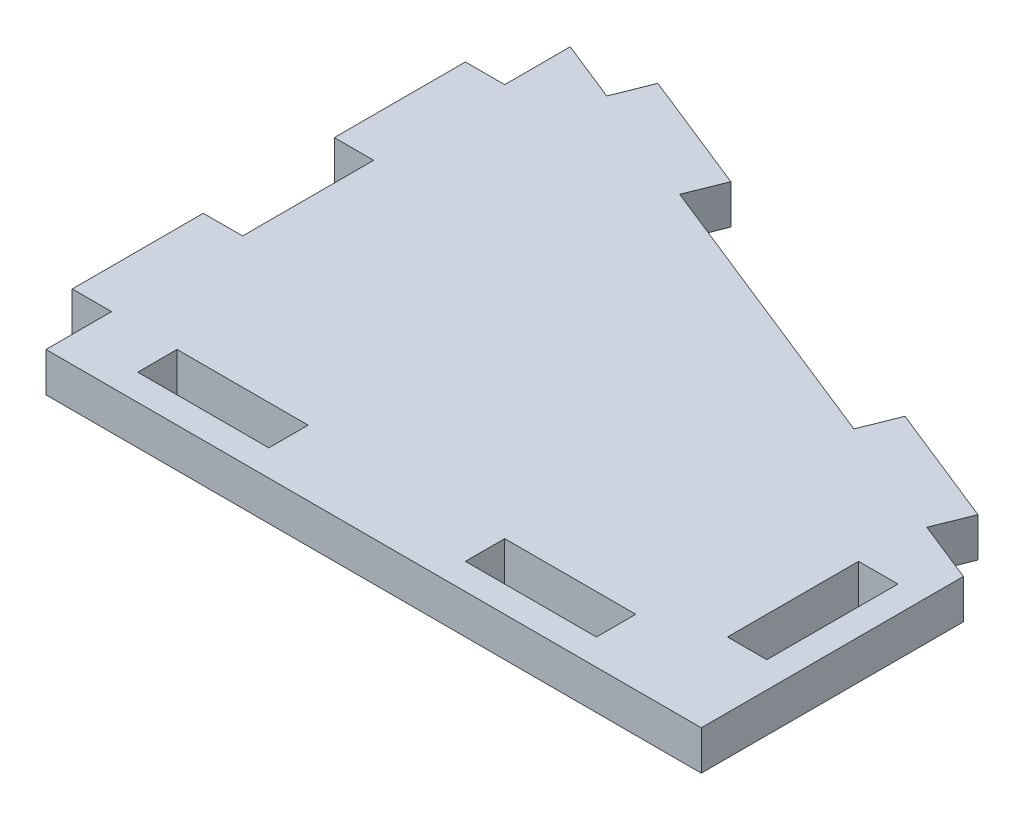
from build123d import *

# Parameters (mm, degrees)
SKETCH1_W           = 10
SKETCH1_H           = 3
SKETCH1_W_2         = 3
SKETCH1_H_2         = 10
BOSS_EXTRUDE1_DEPTH = 3


with BuildPart() as part:
    # Sketch1 → Boss-Extrude1 (new body)
    with BuildSketch(Plane(origin=(0, 0, 0), x_dir=(1, 0, 0), z_dir=(0, 1, 0))):
        Polygon((0, 0), (0, 5), (-3, 5), (-3, 15), (0, 15), (0, 25), (-3, 25), (-3, 35), (0, 35), (0, 40), (4.642383454, 38.143046618), (5.756555483, 40.928476691), (15.041322392, 37.214569927), (13.927150363, 34.429139855), (36.072849637, 25.570860145), (37.187021666, 28.356290218), (46.471788575, 24.642383454), (45.357616546, 21.856953382), (50, 20), (50, 0), align=None)
        with Locations((10, 3.5)):
            Rectangle(SKETCH1_W, SKETCH1_H, mode=Mode.SUBTRACT)
        with Locations((35, 3.5)):
            Rectangle(SKETCH1_W, SKETCH1_H, mode=Mode.SUBTRACT)
        with Locations((46.5, 12)):
            Rectangle(SKETCH1_W_2, SKETCH1_H_2, mode=Mode.SUBTRACT)
    extrude(amount=BOSS_EXTRUDE1_DEPTH)


solid = part.part
